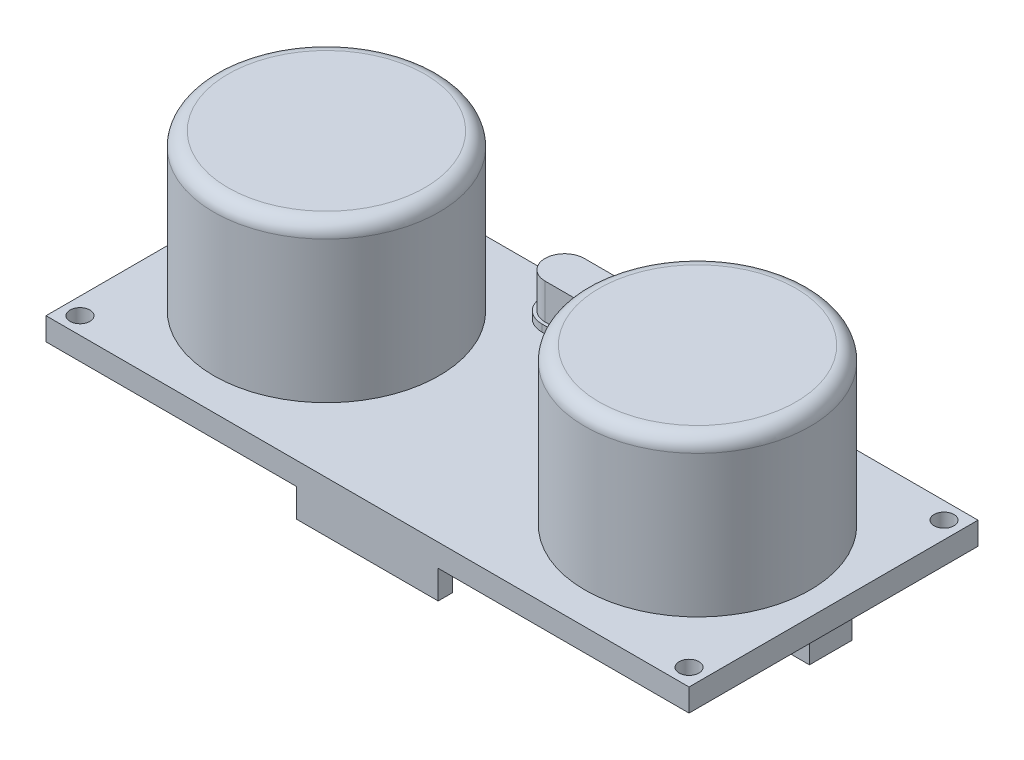
from build123d import *

# Parameters (mm, degrees)
CROQUIS1_W              = 45.4
CROQUIS1_H              = 20.4
SALIENTE_EXTRUIR1_DEPTH = 1.6
CROQUIS2_R              = 0.7
CORTAR_EXTRUIR1_DEPTH   = 1
SALIENTE_EXTRUIR2_DEPTH = 0.5
SALIENTE_EXTRUIR3_DEPTH = 3
CROQUIS9_R              = 7.95
SALIENTE_EXTRUIR4_DEPTH = 11
CROQUIS10_W             = 10
CROQUIS10_H             = 1
SALIENTE_EXTRUIR5_DEPTH = 2
REDONDEO5_R             = 1
CROQUIS13_W             = 9
CROQUIS13_H             = 3
SALIENTE_EXTRUIR6_DEPTH = 1.5
MATRIZL2_COUNT          = 2
MATRIZL2_PITCH          = 18
CROQUIS14_W             = 3
CROQUIS14_H             = 9
SALIENTE_EXTRUIR7_DEPTH = 1.5


with BuildPart() as part:
    # Croquis1 → Saliente-Extruir1 (new body)
    with BuildSketch(Plane(origin=(0, 0, 0), x_dir=(1, 0, 0), z_dir=(0, 1, 0))):
        Rectangle(CROQUIS1_W, CROQUIS1_H)
    extrude(amount=SALIENTE_EXTRUIR1_DEPTH)

    # Croquis2 → Cortar-Extruir1 (cut)
    with BuildSketch(Plane(origin=(0, 1.6, 0), x_dir=(1, 0, 0), z_dir=(0, 1, 0))):
        with Locations(Location((-21.5, 9, 0), (0, 0, 270))):
            Circle(CROQUIS2_R)
        with Locations(Location((21.5, 9, 0), (0, 0, 270))):
            Circle(CROQUIS2_R)
        with Locations(Location((21.5, -9, 0), (0, 0, 270))):
            Circle(CROQUIS2_R)
        with Locations(Location((-21.5, -9, 0), (0, 0, 270))):
            Circle(CROQUIS2_R)
    extrude(amount=-CORTAR_EXTRUIR1_DEPTH, mode=Mode.SUBTRACT)

    # Croquis3 → Saliente-Extruir2 (add)
    with BuildSketch(Plane(origin=(0, 1.6, 0), x_dir=(1, 0, 0), z_dir=(0, 1, 0))):
        with BuildLine():
            Line((-4.202221616, 9.535810589), (4.202221616, 9.535810589))
            ThreePointArc((4.202221616, 9.535810589), (5.818460699, 7.919571506), (4.202221616, 6.303332424))
            Line((4.202221616, 6.303332424), (-4.202221616, 6.303332424))
            ThreePointArc((-4.202221616, 6.303332424), (-5.818460699, 7.919571506), (-4.202221616, 9.535810589))
        make_face()
        with BuildLine():
            Line((-4.202221616, 9.304919292), (4.202221616, 9.304919292))
            ThreePointArc((4.202221616, 9.304919292), (5.587569401, 7.919571506), (4.202221616, 6.534223721))
            Line((4.202221616, 6.534223721), (-4.202221616, 6.534223721))
            ThreePointArc((-4.202221616, 6.534223721), (-5.587569401, 7.919571506), (-4.202221616, 9.304919292))
        make_face(mode=Mode.SUBTRACT)
    extrude(amount=SALIENTE_EXTRUIR2_DEPTH)

    # Croquis8 → Saliente-Extruir3 (add)
    with BuildSketch(Plane(origin=(0, 1.6, 0), x_dir=(1, 0, 0), z_dir=(0, 1, 0))):
        with BuildLine():
            Line((-4.202221616, 9.304919292), (4.202221616, 9.304919292))
            ThreePointArc((4.202221616, 9.304919292), (5.587569401, 7.919571506), (4.202221616, 6.534223721))
            Line((4.202221616, 6.534223721), (-4.202221616, 6.534223721))
            ThreePointArc((-4.202221616, 6.534223721), (-5.587569401, 7.919571506), (-4.202221616, 9.304919292))
        make_face()
    extrude(amount=SALIENTE_EXTRUIR3_DEPTH)

    # Croquis9 → Saliente-Extruir4 (add)
    with BuildSketch(Plane(origin=(0, 1.6, 0), x_dir=(1, 0, 0), z_dir=(0, 1, 0))):
        with Locations(Location((-13.1, 0, 0), (0, 0, 270))):
            Circle(CROQUIS9_R)
        with Locations(Location((13.1, 0, 0), (0, 0, 270))):
            Circle(CROQUIS9_R)
    extrude(amount=SALIENTE_EXTRUIR4_DEPTH)

    # Croquis10 → Saliente-Extruir5 (add)
    with BuildSketch(Plane.XZ):
        with Locations((-0.012747973, 9.7)):
            Rectangle(CROQUIS10_W, CROQUIS10_H)
    extrude(amount=SALIENTE_EXTRUIR5_DEPTH)

    # Redondeo5
    redondeo5_edges = [part.edges().sort_by_distance(p)[0] for p in [
        (-13.1, 12.6, -7.95),
        (13.1, 12.6, -7.95),
    ]]
    fillet(redondeo5_edges, radius=REDONDEO5_R)

    # Croquis13 → Saliente-Extruir6 (add)
    with BuildSketch(Plane.XZ):
        Rectangle(CROQUIS13_W, CROQUIS13_H)
    saliente_extruir6 = extrude(amount=SALIENTE_EXTRUIR6_DEPTH)

    # MatrizL2: Saliente-Extruir6 ×2
    with Locations(*[(i * MATRIZL2_PITCH, 0, 0) for i in range(1, MATRIZL2_COUNT)]):
        add(saliente_extruir6)

    # Croquis14 → Saliente-Extruir7 (add)
    with BuildSketch(Plane.XZ):
        with Locations((-19.2, -0.292211089)):
            Rectangle(CROQUIS14_W, CROQUIS14_H)
    extrude(amount=SALIENTE_EXTRUIR7_DEPTH)


solid = part.part
